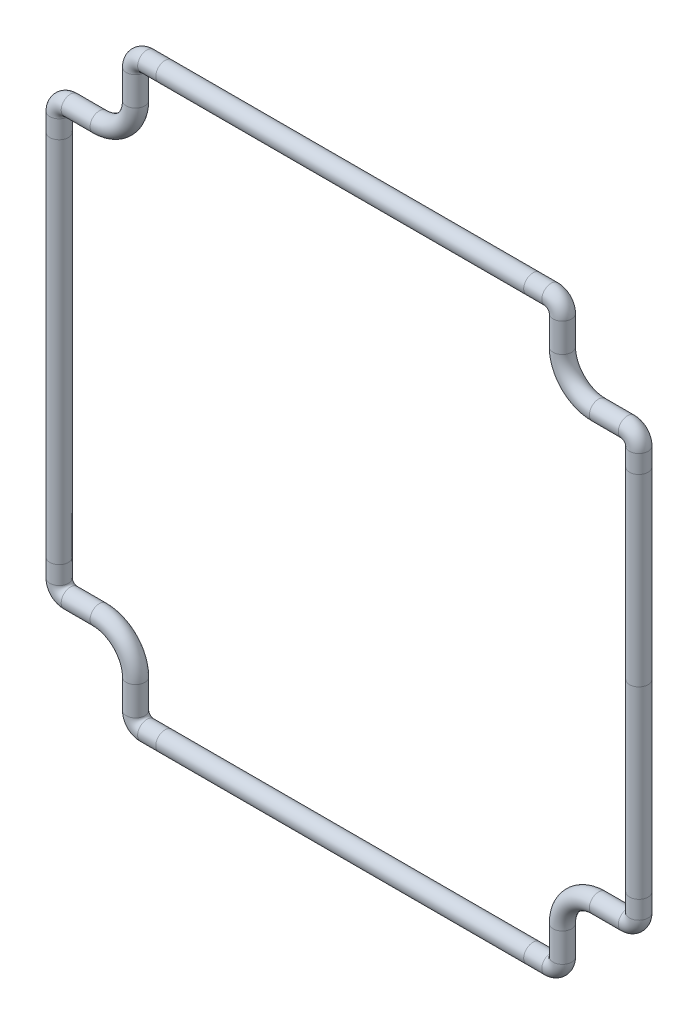
from build123d import *

# Parameters (mm, degrees)
SKETCH6_R = 0.65


with BuildPart() as part:
    # Sweep2: sweep along a path in Sketch4
    with BuildLine(Plane.XY) as sweep2_path:
        Line((-14.9606, 19.52625), (-14.9606, 17.5006))
        ThreePointArc((-14.9606, 17.5006), (-15.704548776, 15.704548776), (-17.5006, 14.9606))
        Line((-17.5006, 14.9606), (-19.52625, 14.9606))
        ThreePointArc((-19.52625, 14.9606), (-20.087516008, 14.728116008), (-20.32, 14.16685))
        Line((-20.32, 14.16685), (-20.32, 12.89685))
        Line((-20.32, 12.89685), (-20.32, -12.89685))
        Line((-20.32, -12.89685), (-20.32, -14.16685))
        ThreePointArc((-20.32, -14.16685), (-20.087516008, -14.728116008), (-19.52625, -14.9606))
        Line((-19.52625, -14.9606), (-17.5006, -14.9606))
        ThreePointArc((-17.5006, -14.9606), (-15.704548776, -15.704548776), (-14.9606, -17.5006))
        Line((-14.9606, -17.5006), (-14.9606, -19.52625))
        ThreePointArc((-14.9606, -19.52625), (-14.728116008, -20.087516008), (-14.16685, -20.32))
        Line((-14.16685, -20.32), (-12.89685, -20.32))
        Line((-12.89685, -20.32), (12.89685, -20.32))
        Line((12.89685, -20.32), (14.16685, -20.32))
        ThreePointArc((14.16685, -20.32), (14.728116008, -20.087516008), (14.9606, -19.52625))
        Line((14.9606, -19.52625), (14.9606, -17.5006))
        ThreePointArc((14.9606, -17.5006), (15.704548776, -15.704548776), (17.5006, -14.9606))
        Line((17.5006, -14.9606), (19.52625, -14.9606))
        ThreePointArc((19.52625, -14.9606), (20.087516008, -14.728116008), (20.32, -14.16685))
        Line((20.32, -14.16685), (20.32, -12.89685))
        Line((20.32, -12.89685), (20.32, 12.89685))
        Line((20.32, 12.89685), (20.32, 14.16685))
        ThreePointArc((20.32, 14.16685), (20.087516008, 14.728116008), (19.52625, 14.9606))
        Line((19.52625, 14.9606), (17.5006, 14.9606))
        ThreePointArc((17.5006, 14.9606), (15.704548776, 15.704548776), (14.9606, 17.5006))
        Line((14.9606, 17.5006), (14.9606, 19.52625))
        ThreePointArc((14.9606, 19.52625), (14.728116008, 20.087516008), (14.16685, 20.32))
        Line((14.16685, 20.32), (12.89685, 20.32))
        Line((12.89685, 20.32), (-12.89685, 20.32))
        Line((-12.89685, 20.32), (-14.16685, 20.32))
        ThreePointArc((-14.16685, 20.32), (-14.728116008, 20.087516008), (-14.9606, 19.52625))
    # Sketch6 → Sweep2 (sweep)
    with BuildSketch(Plane(origin=(0, 0, 0), x_dir=(1, 0, 0), z_dir=(0, 1, 0))):
        with Locations((20.32, 0)):
            Circle(SKETCH6_R)
    sweep(path=sweep2_path.line)


solid = part.part
